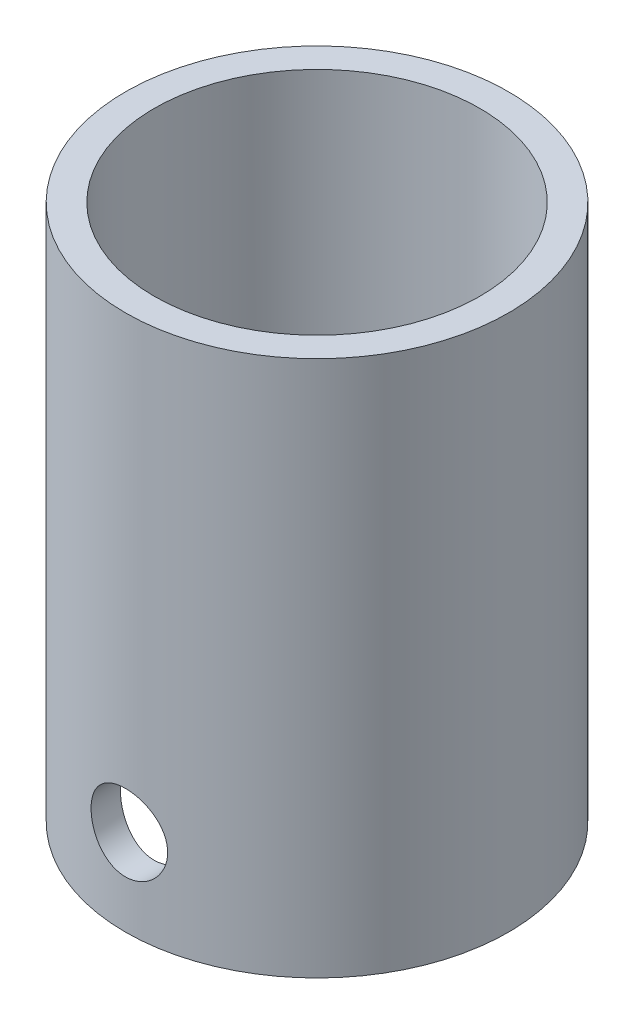
from build123d import *

# Parameters (mm, degrees)
SKETCH_1_R               = 10
SKETCH_1_R_2             = 8.5
EXTRUDE_325_DEPTH        = 28
SKETCH_2_R               = 2
CUT_EXTRUDE_1_DEPTH      = 32.368774283
PATTERN_CIRCULAR_1_COUNT = 2
PATTERN_CIRCULAR_1_ANGLE = 120


with BuildPart() as part:
    # Эскиз1 → Extrude 325 (new body)
    with BuildSketch(Plane(origin=(0, 0, 0), x_dir=(1, 0, 0), z_dir=(0, 1, 0))):
        with Locations(Location((0, 0, 0), (0, 0, 270))):
            Circle(SKETCH_1_R)
        with Locations(Location((0, 0, 0), (0, 0, 270))):
            Circle(SKETCH_1_R_2, mode=Mode.SUBTRACT)
    extrude(amount=EXTRUDE_325_DEPTH)

    # Эскиз2 → отверстие чтоб прикрутиться 1 (cut, through all)
    with BuildSketch(Plane.XY):
        with Locations(Location((0, 4.5, 0), (0, 0, 269.999999945))):
            Circle(SKETCH_2_R)
    cut_extrude_1 = extrude(amount=CUT_EXTRUDE_1_DEPTH, mode=Mode.SUBTRACT)

    # Круговой массив1: отверстие чтоб прикрутиться 1 ×2 about axis
    pattern_circular_1_axis = Axis((0, 28, 0), (0, -1, 0))
    for i in range(1, PATTERN_CIRCULAR_1_COUNT):
        add(cut_extrude_1.rotate(pattern_circular_1_axis, i * PATTERN_CIRCULAR_1_ANGLE / (PATTERN_CIRCULAR_1_COUNT - 1)), mode=Mode.SUBTRACT)


solid = part.part
